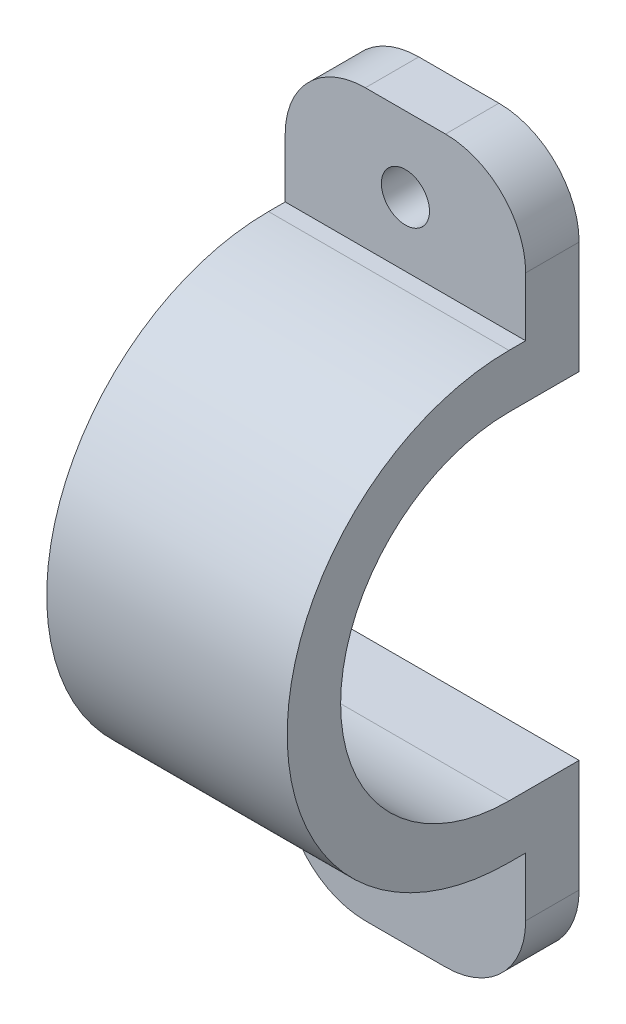
from build123d import *

# Parameters (mm, degrees)
MOTOR_CLAMP_EXTRUDE_DEPTH = 18
CLAMP_MOUNTING_HOLE_D     = 3.6
CLAMP_CORNER_FILLETS_R    = 6


with BuildPart() as part:
    # Motor Clamp Sketch → Motor Clamp Extrude (new body)
    with BuildSketch(Plane(origin=(0, 0, 0), x_dir=(0, 0, -1), z_dir=(1, 0, 0))):
        with BuildLine():
            Line((-17.75, -16.6), (-16.5, -16.6))
            Line((-16.5, -16.6), (-16.5, -27))
            Line((-16.5, -27), (-12.5, -27))
            Line((-12.5, -27), (-12.5, -12.6))
            Line((-12.5, -12.6), (-17.75, -12.6))
            ThreePointArc((-17.75, -12.6), (-30.35, 0), (-17.75, 12.6))
            Line((-17.75, 12.6), (-12.5, 12.6))
            Line((-12.5, 12.6), (-12.5, 27))
            Line((-12.5, 27), (-16.5, 27))
            Line((-16.5, 27), (-16.5, 16.6))
            Line((-16.5, 16.6), (-17.75, 16.6))
            ThreePointArc((-17.75, 16.6), (-34.35, 0), (-17.75, -16.6))
        make_face()
    extrude(amount=MOTOR_CLAMP_EXTRUDE_DEPTH)

    # Clamp Mounting Hole (through all)
    with Locations(Plane.XY.offset(16.5)):
        with Locations((9, -21.4)):
            clamp_mounting_hole = Hole(CLAMP_MOUNTING_HOLE_D / 2)

    # Clamp Hole Mirro: Clamp Mounting Hole across plane
    add(clamp_mounting_hole.mirror(Plane.ZX), mode=Mode.SUBTRACT)

    # Clamp Corner Fillets
    clamp_corner_fillets_edges = [part.edges().sort_by_distance(p)[0] for p in [
        (0, 27, 14.5),
        (0, -27, 14.5),
        (18, -27, 14.5),
        (18, 27, 14.5),
    ]]
    fillet(clamp_corner_fillets_edges, radius=CLAMP_CORNER_FILLETS_R)


solid = part.part
